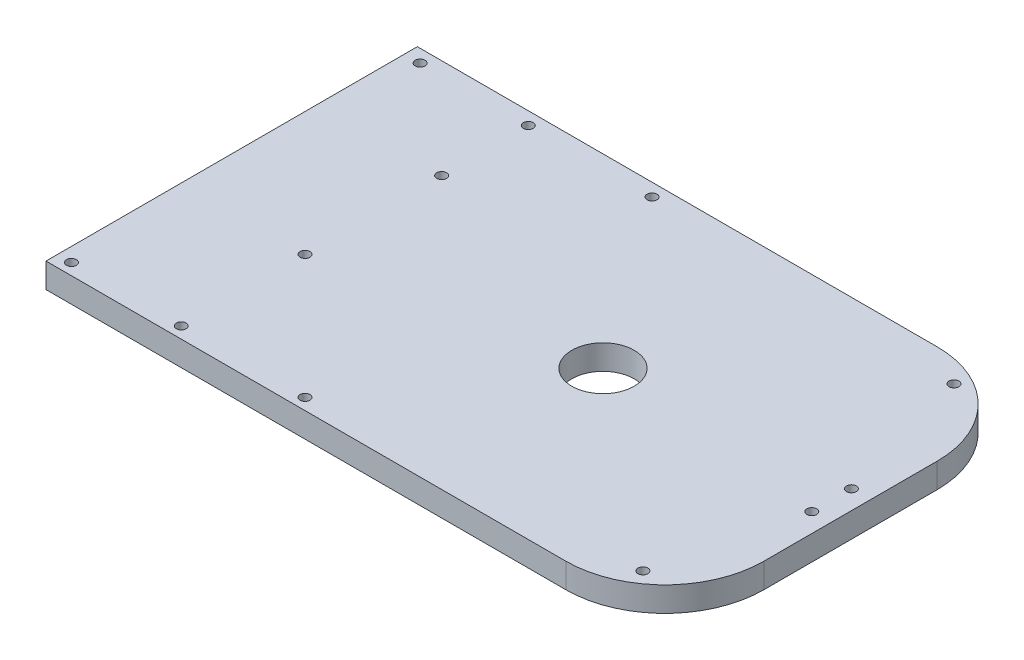
from build123d import *

# Parameters (mm, degrees)
BOSS_EXTRUDE1_DEPTH = 10
SKETCH2_R           = 12.59794853
CUT_EXTRUDE1_DEPTH  = 292.719042916
SKETCH3_R           = 2
CUT_EXTRUDE10_DEPTH = 292.719042916
SKETCH4_R           = 2
CUT_EXTRUDE11_DEPTH = 292.719042916
SKETCH5_R           = 2
CUT_EXTRUDE12_DEPTH = 292.719042916
SKETCH6_R           = 2
CUT_EXTRUDE13_DEPTH = 292.719042916
SKETCH10_R          = 2
CUT_EXTRUDE15_DEPTH = 292.719042916
SKETCH11_R          = 2
CUT_EXTRUDE16_DEPTH = 292.719042916


with BuildPart() as part:
    # Sketch1 → Boss-Extrude1 (new body)
    with BuildSketch(Plane(origin=(0, 0, 0), x_dir=(1, 0, 0), z_dir=(0, 1, 0))):
        with BuildLine():
            Line((0, 0), (210, 0))
            ThreePointArc((210, 0), (238.284271247, 11.715728753), (250, 40))
            Line((250, 40), (250, 110))
            ThreePointArc((250, 110), (238.284271247, 138.284271247), (210, 150))
            Line((210, 150), (0, 150))
            Line((0, 150), (0, 0))
        make_face()
    extrude(amount=BOSS_EXTRUDE1_DEPTH)

    # Sketch2 → Cut-Extrude1 (cut, through all)
    with BuildSketch(Plane.XZ):
        with Locations(Location((150, -75, 0), (0, 0, 270))):
            Circle(SKETCH2_R)
    extrude(amount=-CUT_EXTRUDE1_DEPTH, mode=Mode.SUBTRACT)

    # Sketch3 → Cut-Extrude10 (cut, through all)
    with BuildSketch(Plane(origin=(0, 10, 0), x_dir=(1, 0, 0), z_dir=(0, 1, 0))):
        with Locations(Location((6.310878228, 144.817130454, 0), (0, 0, 270))):
            Circle(SKETCH3_R)
    extrude(amount=-CUT_EXTRUDE10_DEPTH, mode=Mode.SUBTRACT)

    # Sketch4 → Cut-Extrude11 (cut, through all)
    with BuildSketch(Plane(origin=(0, 10, 0), x_dir=(1, 0, 0), z_dir=(0, 1, 0))):
        with Locations(Location((5.635720357, 4.632829204, 0), (0, 0, 270))):
            Circle(SKETCH4_R)
    extrude(amount=-CUT_EXTRUDE11_DEPTH, mode=Mode.SUBTRACT)

    # Sketch5 → Cut-Extrude12 (cut, through all)
    with BuildSketch(Plane(origin=(0, 10, 0), x_dir=(1, 0, 0), z_dir=(0, 1, 0))):
        with Locations(Location((226.364130141, 140.421237055, 0), (0, 0, 270))):
            Circle(SKETCH5_R)
    extrude(amount=-CUT_EXTRUDE12_DEPTH, mode=Mode.SUBTRACT)

    # Sketch6 → Cut-Extrude13 (cut, through all)
    with BuildSketch(Plane(origin=(0, 10, 0), x_dir=(1, 0, 0), z_dir=(0, 1, 0))):
        with Locations(Location((228.949949788, 12.164582591, 0), (0, 0, 270))):
            Circle(SKETCH6_R)
    extrude(amount=-CUT_EXTRUDE13_DEPTH, mode=Mode.SUBTRACT)

    # Sketch10 → Cut-Extrude15 (cut, through all)
    with BuildSketch(Plane(origin=(0, 10, 0), x_dir=(1, 0, 0), z_dir=(0, 1, 0))):
        with Locations(Location((50, 144.82, 0), (0, 0, 270))):
            Circle(SKETCH10_R)
        with Locations(Location((50, 4.63, 0), (0, 0, 270))):
            Circle(SKETCH10_R)
        with Locations(Location((100, 4.63, 0), (0, 0, 270))):
            Circle(SKETCH10_R)
        with Locations(Location((100, 144.82, 0), (0, 0, 270))):
            Circle(SKETCH10_R)
        with Locations(Location((50, 109.82, 0), (0, 0, 270))):
            Circle(SKETCH10_R)
        with Locations(Location((50, 54.63, 0), (0, 0, 270))):
            Circle(SKETCH10_R)
    extrude(amount=-CUT_EXTRUDE15_DEPTH, mode=Mode.SUBTRACT)

    # Sketch11 → Cut-Extrude16 (cut, through all)
    with BuildSketch(Plane(origin=(0, 10, 0), x_dir=(1, 0, 0), z_dir=(0, 1, 0))):
        with Locations(Location((242.34, 83, 0), (0, 0, 270))):
            Circle(SKETCH11_R)
        with Locations(Location((242.34, 67, 0), (0, 0, 270))):
            Circle(SKETCH11_R)
    extrude(amount=-CUT_EXTRUDE16_DEPTH, mode=Mode.SUBTRACT)


solid = part.part
